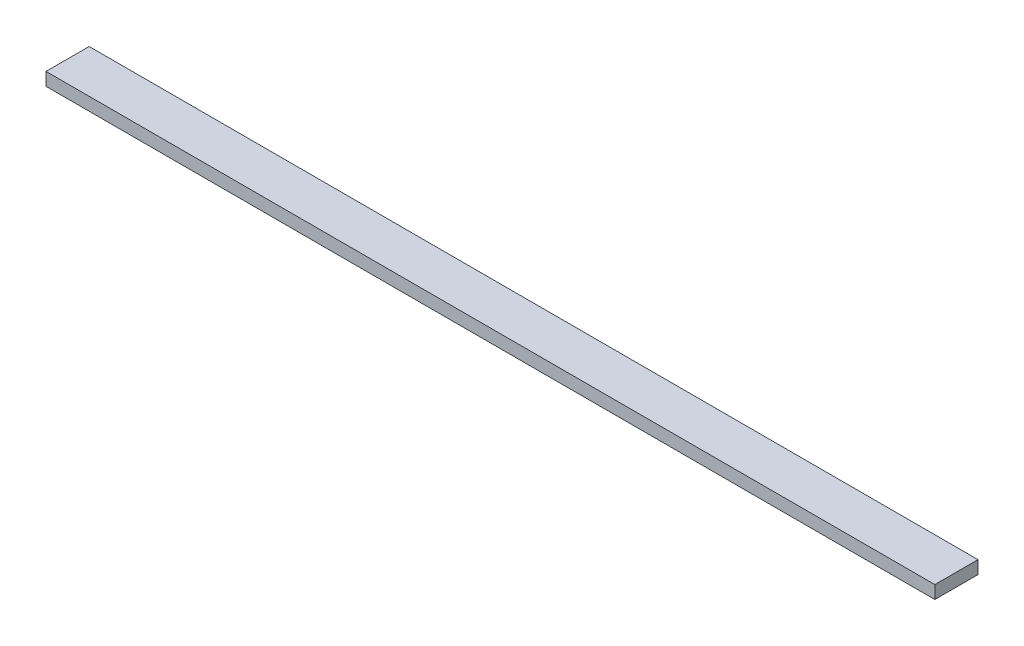
from build123d import *

# Parameters (mm, degrees)
SKETCH1_W           = 206
SKETCH1_H           = 10
BOSS_EXTRUDE1_DEPTH = 1.5


with BuildPart() as part:
    # Sketch1 → Boss-Extrude1 (new, symmetric)
    with BuildSketch(Plane(origin=(0, 0, 0), x_dir=(1, 0, 0), z_dir=(0, 1, 0))):
        Rectangle(SKETCH1_W, SKETCH1_H)
    extrude(amount=BOSS_EXTRUDE1_DEPTH, both=True)


solid = part.part
